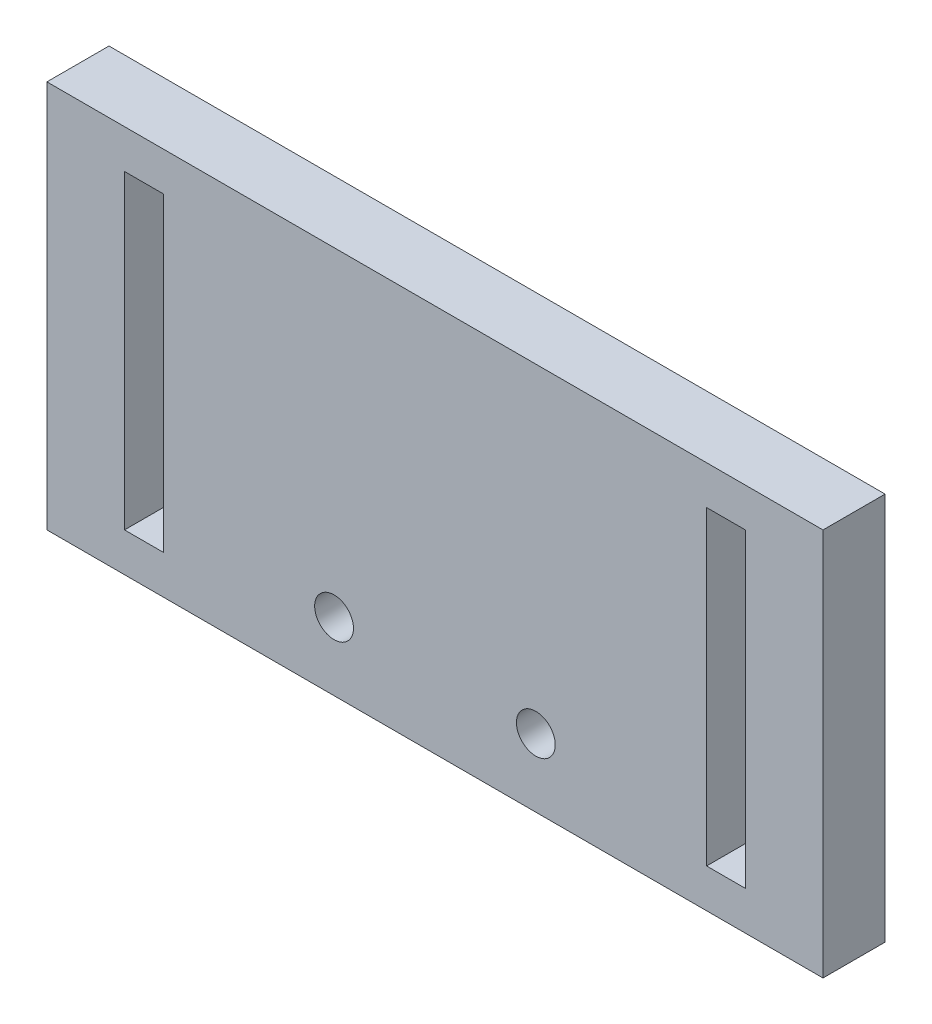
from build123d import *

# Parameters (mm, degrees)
SKETCH1_W           = 100
SKETCH1_H           = 50
SKETCH1_R           = 2.5
SKETCH1_W_2         = 5
SKETCH1_H_2         = 40
BOSS_EXTRUDE1_DEPTH = 8


with BuildPart() as part:
    # Sketch1 → Boss-Extrude1 (new body)
    with BuildSketch(Plane.XY):
        Rectangle(SKETCH1_W, SKETCH1_H)
        with Locations((-13, -16.244168493)):
            Circle(SKETCH1_R, mode=Mode.SUBTRACT)
        with Locations((13, -16.244168493)):
            Circle(SKETCH1_R, mode=Mode.SUBTRACT)
        with Locations((-37.5, 0)):
            Rectangle(SKETCH1_W_2, SKETCH1_H_2, mode=Mode.SUBTRACT)
        with Locations((37.5, 0)):
            Rectangle(SKETCH1_W_2, SKETCH1_H_2, mode=Mode.SUBTRACT)
    extrude(amount=BOSS_EXTRUDE1_DEPTH)


solid = part.part
